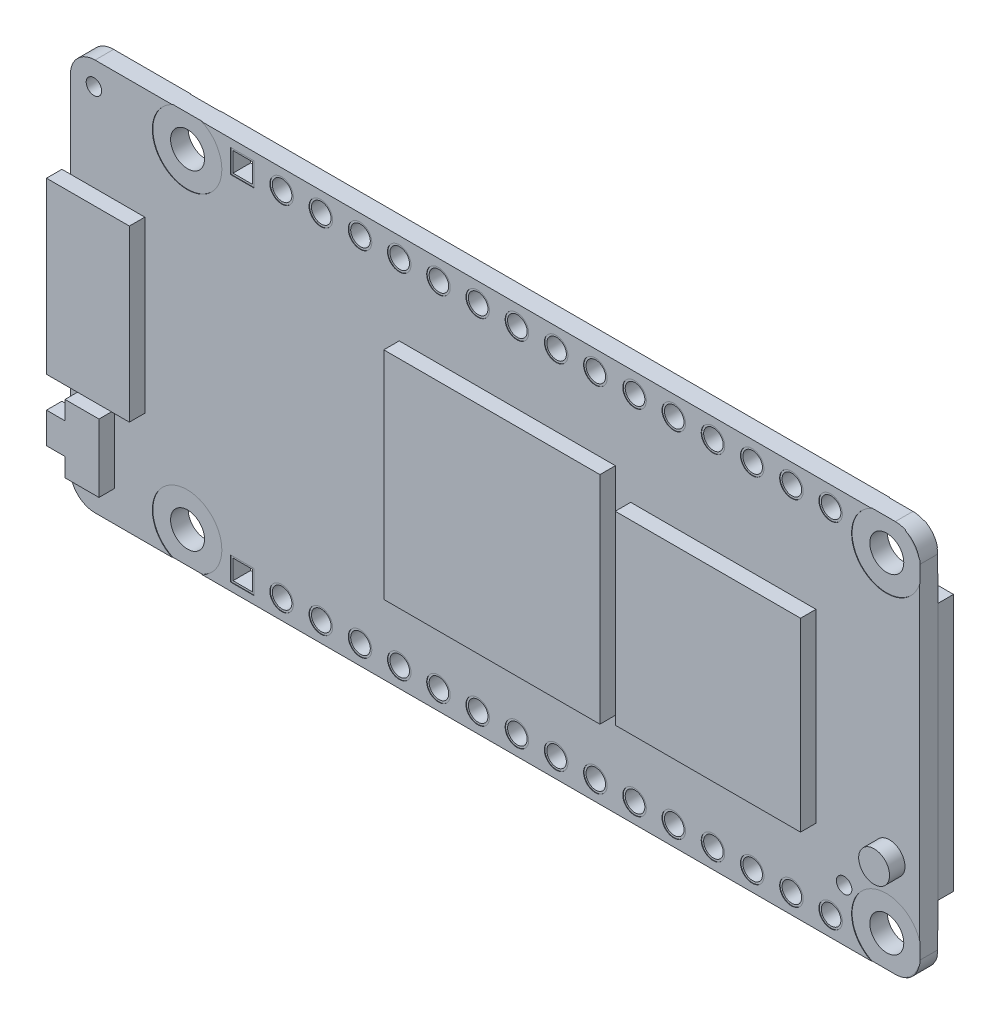
from build123d import *

# Parameters (mm, degrees)
SKETCH_3_R          = 1.099998
SKETCH_3_R_2        = 0.635
SKETCH_3_R_3        = 0.5
SKETCH_3_W          = 1.27
SKETCH_3_H          = 1.27
EXTRUDE_1_DEPTH     = 1.2
SKETCH_4_R          = 1
SKETCH_4_W          = 14.000404
SKETCH_4_H          = 14.000378
SKETCH_4_W_2        = 11.999976
SKETCH_4_H_2        = 11.999976
SKETCH_4_W_3        = 5.368265
SKETCH_4_H_3        = 10.999978
EXTRUDE_2_DEPTH     = 1
EXTRUDE_START       = -1.2
SKETCH_5_W          = 7.50001
SKETCH_5_H          = 13.299998
EXTRUDE_3_DEPTH     = 1
SKETCH_6_R          = 2.250008
SKETCH_6_R_2        = 0.762
SKETCH_6_W          = 1.524
SKETCH_6_H          = 1.524
CUT_EXTRUDE_1_DEPTH = 0.03
CUT_EXTRUDE_START   = -1.17
SKETCH_7_R          = 2.250008
SKETCH_7_R_2        = 0.762
SKETCH_7_W          = 1.524
SKETCH_7_H          = 1.524
CUT_EXTRUDE_2_DEPTH = 0.03


with BuildPart() as part:
    # 草图3 → 凸台-拉伸1 (new body)
    with BuildSketch(Plane.XY):
        with BuildLine():
            Line((1.599997, 25.4), (53.399995, 25.4))
            ThreePointArc((53.399995, 25.4), (54.531363279, 24.931371279), (54.999992, 23.800003))
            Line((54.999992, 23.800003), (54.999992, 1.599997))
            ThreePointArc((54.999992, 1.599997), (54.531363279, 0.468628721), (53.399995, 0))
            Line((53.399995, 0), (1.600001267, 0))
            ThreePointArc((1.600001267, 0), (0.46863103, 0.468628013), (0, 1.599997))
            Line((0, 1.599997), (0, 23.800003))
            ThreePointArc((0, 23.800003), (0.468629521, 24.931370479), (1.599997, 25.4))
        make_face()
        with Locations((7.559802, 23.368)):
            Circle(SKETCH_3_R, mode=Mode.SUBTRACT)
        with Locations((7.559802, 2.032)):
            Circle(SKETCH_3_R, mode=Mode.SUBTRACT)
        with Locations((52.848002, 2.032)):
            Circle(SKETCH_3_R, mode=Mode.SUBTRACT)
        with Locations((52.848002, 23.368)):
            Circle(SKETCH_3_R, mode=Mode.SUBTRACT)
        with Locations((13.680796, 1.27)):
            Circle(SKETCH_3_R_2, mode=Mode.SUBTRACT)
        with Locations((16.220796, 1.27)):
            Circle(SKETCH_3_R_2, mode=Mode.SUBTRACT)
        with Locations((18.760796, 1.27)):
            Circle(SKETCH_3_R_2, mode=Mode.SUBTRACT)
        with Locations((21.300796, 1.27)):
            Circle(SKETCH_3_R_2, mode=Mode.SUBTRACT)
        with Locations((23.840796, 1.27)):
            Circle(SKETCH_3_R_2, mode=Mode.SUBTRACT)
        with Locations((26.380796, 1.27)):
            Circle(SKETCH_3_R_2, mode=Mode.SUBTRACT)
        with Locations((36.540796, 1.27)):
            Circle(SKETCH_3_R_2, mode=Mode.SUBTRACT)
        with Locations((31.460796, 1.27)):
            Circle(SKETCH_3_R_2, mode=Mode.SUBTRACT)
        with Locations((28.920796, 1.27)):
            Circle(SKETCH_3_R_2, mode=Mode.SUBTRACT)
        with Locations((34.000796, 1.27)):
            Circle(SKETCH_3_R_2, mode=Mode.SUBTRACT)
        with Locations((39.080796, 1.27)):
            Circle(SKETCH_3_R_2, mode=Mode.SUBTRACT)
        with Locations((41.620796, 1.27)):
            Circle(SKETCH_3_R_2, mode=Mode.SUBTRACT)
        with Locations((46.700796, 1.27)):
            Circle(SKETCH_3_R_2, mode=Mode.SUBTRACT)
        with Locations((44.160796, 1.27)):
            Circle(SKETCH_3_R_2, mode=Mode.SUBTRACT)
        with Locations((49.240796, 1.27)):
            Circle(SKETCH_3_R_2, mode=Mode.SUBTRACT)
        with Locations((13.680796, 24.13)):
            Circle(SKETCH_3_R_2, mode=Mode.SUBTRACT)
        with Locations((16.220796, 24.13)):
            Circle(SKETCH_3_R_2, mode=Mode.SUBTRACT)
        with Locations((18.760796, 24.13)):
            Circle(SKETCH_3_R_2, mode=Mode.SUBTRACT)
        with Locations((21.300796, 24.13)):
            Circle(SKETCH_3_R_2, mode=Mode.SUBTRACT)
        with Locations((23.840796, 24.13)):
            Circle(SKETCH_3_R_2, mode=Mode.SUBTRACT)
        with Locations((26.380796, 24.13)):
            Circle(SKETCH_3_R_2, mode=Mode.SUBTRACT)
        with Locations((28.920796, 24.13)):
            Circle(SKETCH_3_R_2, mode=Mode.SUBTRACT)
        with Locations((31.460796, 24.13)):
            Circle(SKETCH_3_R_2, mode=Mode.SUBTRACT)
        with Locations((34.000796, 24.13)):
            Circle(SKETCH_3_R_2, mode=Mode.SUBTRACT)
        with Locations((36.540796, 24.13)):
            Circle(SKETCH_3_R_2, mode=Mode.SUBTRACT)
        with Locations((39.080796, 24.13)):
            Circle(SKETCH_3_R_2, mode=Mode.SUBTRACT)
        with Locations((41.620796, 24.13)):
            Circle(SKETCH_3_R_2, mode=Mode.SUBTRACT)
        with Locations((44.160796, 24.13)):
            Circle(SKETCH_3_R_2, mode=Mode.SUBTRACT)
        with Locations((46.700796, 24.13)):
            Circle(SKETCH_3_R_2, mode=Mode.SUBTRACT)
        with Locations((49.240796, 24.13)):
            Circle(SKETCH_3_R_2, mode=Mode.SUBTRACT)
        with Locations((1.524, 23.876)):
            Circle(SKETCH_3_R_3, mode=Mode.SUBTRACT)
        with Locations((50.1142, 3.3782)):
            Circle(SKETCH_3_R_3, mode=Mode.SUBTRACT)
        with Locations((11.140796, 24.13)):
            Rectangle(SKETCH_3_W, SKETCH_3_H, mode=Mode.SUBTRACT)
        with Locations((11.140796, 1.27)):
            Rectangle(SKETCH_3_W, SKETCH_3_H, mode=Mode.SUBTRACT)
    extrude(amount=-EXTRUDE_1_DEPTH)

    # 草图4 → 凸台-拉伸2 (add)
    with BuildSketch(Plane.XY):
        with Locations((53.056121172, 6.390996)):
            Circle(SKETCH_4_R)
        Polygon((0.651942, 6.390996), (0.651942, 5.190998), (-0.548056, 5.190998), (-0.548056, 3.191002), (0.651942, 3.191002), (0.651942, 1.991004), (2.851937, 1.991004), (2.851937, 6.390996), align=None)
        with Locations((28.298407, 12.4968)):
            Rectangle(SKETCH_4_W, SKETCH_4_H)
        with Locations((42.291, 11.938)):
            Rectangle(SKETCH_4_W_2, SKETCH_4_H_2)
        with Locations((2.1360765, 12.7)):
            Rectangle(SKETCH_4_W_3, SKETCH_4_H_3)
    extrude(amount=EXTRUDE_2_DEPTH)

    # 草图5 → 凸台-拉伸3 (add)
    with BuildSketch(Plane.XY.offset(EXTRUDE_START)):
        Polygon((12.972999, 20.733309), (12.972999, 19.513601), (13.938199, 19.513601), (13.938199, 6.713601), (13.328599, 6.713601), (13.328599, 6.307201), (1.187399, 6.307201), (1.187399, 20.733309), align=None)
        with Locations((19.459194, 15.24)):
            Rectangle(SKETCH_5_W, SKETCH_5_H)
        Polygon((17.405909, 8.319389), (22.685909, 8.319389), (22.685908, 3.039389), (17.405909, 3.039389), align=None)
        Polygon((54.99862, 21.029168), (49.0855, 21.029168), (49.0855, 4.370832), (54.999992, 4.370832), align=None)
    extrude(amount=-EXTRUDE_3_DEPTH)

    # 草图6 → 切除-拉伸1 (cut)
    with BuildSketch(Plane.XY):
        with Locations((7.559802, 2.032)):
            Circle(SKETCH_6_R)
        with Locations((7.559802, 23.368)):
            Circle(SKETCH_6_R)
        with Locations((52.848002, 23.368)):
            Circle(SKETCH_6_R)
        with Locations((52.848002, 2.032)):
            Circle(SKETCH_6_R)
        with Locations((13.680796, 24.13)):
            Circle(SKETCH_6_R_2)
        with Locations((16.220796, 24.13)):
            Circle(SKETCH_6_R_2)
        with Locations((18.760796, 24.13)):
            Circle(SKETCH_6_R_2)
        with Locations((21.300796, 24.13)):
            Circle(SKETCH_6_R_2)
        with Locations((23.840796, 24.13)):
            Circle(SKETCH_6_R_2)
        with Locations((26.380796, 24.13)):
            Circle(SKETCH_6_R_2)
        with Locations((28.920796, 24.13)):
            Circle(SKETCH_6_R_2)
        with Locations((31.460796, 24.13)):
            Circle(SKETCH_6_R_2)
        with Locations((34.000796, 24.13)):
            Circle(SKETCH_6_R_2)
        with Locations((36.540796, 24.13)):
            Circle(SKETCH_6_R_2)
        with Locations((39.080796, 24.13)):
            Circle(SKETCH_6_R_2)
        with Locations((41.620796, 24.13)):
            Circle(SKETCH_6_R_2)
        with Locations((44.160796, 24.13)):
            Circle(SKETCH_6_R_2)
        with Locations((46.700796, 24.13)):
            Circle(SKETCH_6_R_2)
        with Locations((49.240796, 24.13)):
            Circle(SKETCH_6_R_2)
        with Locations((49.240796, 1.27)):
            Circle(SKETCH_6_R_2)
        with Locations((46.700796, 1.27)):
            Circle(SKETCH_6_R_2)
        with Locations((44.160796, 1.27)):
            Circle(SKETCH_6_R_2)
        with Locations((41.620796, 1.27)):
            Circle(SKETCH_6_R_2)
        with Locations((39.080796, 1.27)):
            Circle(SKETCH_6_R_2)
        with Locations((36.540796, 1.27)):
            Circle(SKETCH_6_R_2)
        with Locations((34.000796, 1.27)):
            Circle(SKETCH_6_R_2)
        with Locations((31.460796, 1.27)):
            Circle(SKETCH_6_R_2)
        with Locations((28.920796, 1.27)):
            Circle(SKETCH_6_R_2)
        with Locations((26.380796, 1.27)):
            Circle(SKETCH_6_R_2)
        with Locations((23.840796, 1.27)):
            Circle(SKETCH_6_R_2)
        with Locations((21.300796, 1.27)):
            Circle(SKETCH_6_R_2)
        with Locations((18.760796, 1.27)):
            Circle(SKETCH_6_R_2)
        with Locations((13.680796, 1.27)):
            Circle(SKETCH_6_R_2)
        with Locations((16.220796, 1.27)):
            Circle(SKETCH_6_R_2)
        with Locations((11.140796, 24.13)):
            Rectangle(SKETCH_6_W, SKETCH_6_H)
        with Locations((11.140796, 1.27)):
            Rectangle(SKETCH_6_W, SKETCH_6_H)
    extrude(amount=-CUT_EXTRUDE_1_DEPTH, mode=Mode.SUBTRACT)

    # 草图7 → 切除-拉伸2 (cut)
    with BuildSketch(Plane.XY.offset(CUT_EXTRUDE_START)):
        with Locations((7.559802, 23.368)):
            Circle(SKETCH_7_R)
        with Locations((13.680796, 24.13)):
            Circle(SKETCH_7_R_2)
        with Locations((7.559802, 2.032)):
            Circle(SKETCH_7_R)
        with Locations((13.680796, 1.27)):
            Circle(SKETCH_7_R_2)
        with Locations((52.848002, 2.032)):
            Circle(SKETCH_7_R)
        with Locations((49.240796, 1.27)):
            Circle(SKETCH_7_R_2)
        with Locations((46.700796, 1.27)):
            Circle(SKETCH_7_R_2)
        with Locations((44.160796, 1.27)):
            Circle(SKETCH_7_R_2)
        with Locations((41.620796, 1.27)):
            Circle(SKETCH_7_R_2)
        with Locations((39.080796, 1.27)):
            Circle(SKETCH_7_R_2)
        with Locations((36.540796, 1.27)):
            Circle(SKETCH_7_R_2)
        with Locations((34.000796, 1.27)):
            Circle(SKETCH_7_R_2)
        with Locations((31.460796, 1.27)):
            Circle(SKETCH_7_R_2)
        with Locations((28.920796, 1.27)):
            Circle(SKETCH_7_R_2)
        with Locations((26.380796, 1.27)):
            Circle(SKETCH_7_R_2)
        with Locations((23.840796, 1.27)):
            Circle(SKETCH_7_R_2)
        with Locations((21.300796, 1.27)):
            Circle(SKETCH_7_R_2)
        with Locations((18.760796, 1.27)):
            Circle(SKETCH_7_R_2)
        with Locations((16.220796, 1.27)):
            Circle(SKETCH_7_R_2)
        with Locations((52.848002, 23.368)):
            Circle(SKETCH_7_R)
        with Locations((49.240796, 24.13)):
            Circle(SKETCH_7_R_2)
        with Locations((46.700796, 24.13)):
            Circle(SKETCH_7_R_2)
        with Locations((44.160796, 24.13)):
            Circle(SKETCH_7_R_2)
        with Locations((41.620796, 24.13)):
            Circle(SKETCH_7_R_2)
        with Locations((39.080796, 24.13)):
            Circle(SKETCH_7_R_2)
        with Locations((36.540796, 24.13)):
            Circle(SKETCH_7_R_2)
        with Locations((34.000796, 24.13)):
            Circle(SKETCH_7_R_2)
        with Locations((16.220796, 24.13)):
            Circle(SKETCH_7_R_2)
        with Locations((18.760796, 24.13)):
            Circle(SKETCH_7_R_2)
        with Locations((21.300796, 24.13)):
            Circle(SKETCH_7_R_2)
        with Locations((23.840796, 24.13)):
            Circle(SKETCH_7_R_2)
        with Locations((26.380796, 24.13)):
            Circle(SKETCH_7_R_2)
        with Locations((28.920796, 24.13)):
            Circle(SKETCH_7_R_2)
        with Locations((31.460796, 24.13)):
            Circle(SKETCH_7_R_2)
        with Locations((11.140796, 24.13)):
            Rectangle(SKETCH_7_W, SKETCH_7_H)
        with Locations((11.140796, 1.27)):
            Rectangle(SKETCH_7_W, SKETCH_7_H)
    extrude(amount=-CUT_EXTRUDE_2_DEPTH, mode=Mode.SUBTRACT)


solid = part.part
